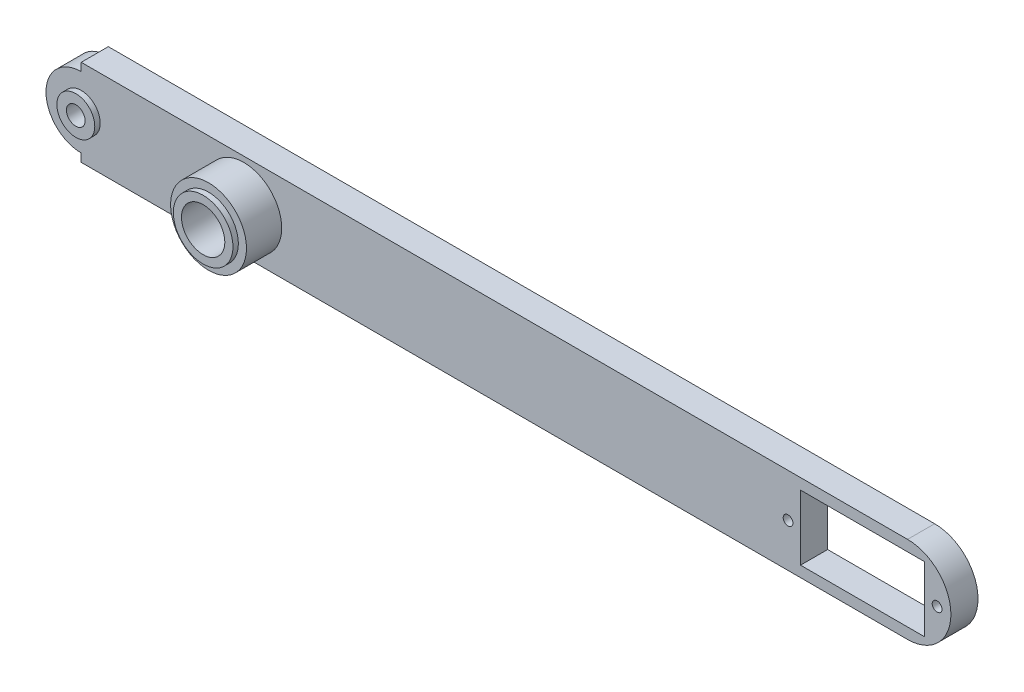
from build123d import *

# Parameters (mm, degrees)
BOSS_EXTRUDE1_START     = -9
SKETCH1_W               = 152.5
SKETCH1_H               = 16
BOSS_EXTRUDE1_DEPTH     = 5
BOSS_EXTRUDE2_START     = -9
SKETCH2_R               = 6.5
BOSS_EXTRUDE2_DEPTH     = 5
BOSS_EXTRUDE3_START     = -9
SKETCH3_R               = 8
BOSS_EXTRUDE3_DEPTH     = 5
BOSS_EXTRUDE4_START     = -9
SKETCH4_R               = 7
BOSS_EXTRUDE4_DEPTH     = 11.5
BOSS_EXTRUDE5_START     = 2.5
SKETCH5_R               = 5.5
BOSS_EXTRUDE5_DEPTH     = 1
BOSS_EXTRUDE6_START     = -4
SKETCH6_R               = 3.5
BOSS_EXTRUDE6_DEPTH     = 1
CUT_EXTRUDE1_DEPTH      = 132.054378027
CUT_EXTRUDE1_DEPTH_BACK = 132.054378027
SKETCH7_R               = 4
CUT_EXTRUDE2_DEPTH      = 132.054378027
CUT_EXTRUDE2_DEPTH_BACK = 132.054378027
SKETCH8_R               = 1.725
CUT_EXTRUDE3_DEPTH      = 132.054378027
CUT_EXTRUDE3_DEPTH_BACK = 132.054378027
SKETCH9_W               = 22.9
SKETCH9_H               = 12
CUT_EXTRUDE4_DEPTH      = 132.054378027
CUT_EXTRUDE4_DEPTH_BACK = 132.054378027
SKETCH10_R              = 0.9
CUT_EXTRUDE5_START      = -9
SKETCH11_R              = 2
CUT_EXTRUDE5_DEPTH      = 4


with BuildPart() as part:
    # Sketch1 → Boss-Extrude1 (new body)
    with BuildSketch(Plane.XY.offset(BOSS_EXTRUDE1_START)):
        with Locations((46.25, 0)):
            Rectangle(SKETCH1_W, SKETCH1_H)
    extrude(amount=BOSS_EXTRUDE1_DEPTH)

    # Sketch2 → Boss-Extrude2 (add)
    with BuildSketch(Plane.XY.offset(BOSS_EXTRUDE2_START)):
        with Locations((-30, 0)):
            Circle(SKETCH2_R)
    extrude(amount=BOSS_EXTRUDE2_DEPTH)

    # Sketch3 → Boss-Extrude3 (add)
    with BuildSketch(Plane.XY.offset(BOSS_EXTRUDE3_START)):
        with Locations((122.5, 0)):
            Circle(SKETCH3_R)
    extrude(amount=BOSS_EXTRUDE3_DEPTH)

    # Sketch4 → Boss-Extrude4 (add)
    with BuildSketch(Plane.XY.offset(BOSS_EXTRUDE4_START)):
        Circle(SKETCH4_R)
    extrude(amount=BOSS_EXTRUDE4_DEPTH)

    # Sketch5 → Boss-Extrude5 (add)
    with BuildSketch(Plane.XY.offset(BOSS_EXTRUDE5_START)):
        Circle(SKETCH5_R)
    extrude(amount=BOSS_EXTRUDE5_DEPTH)

    # Sketch6 → Boss-Extrude6 (add)
    with BuildSketch(Plane.XY.offset(BOSS_EXTRUDE6_START)):
        with Locations((-30, 0)):
            Circle(SKETCH6_R)
    extrude(amount=BOSS_EXTRUDE6_DEPTH)

    # Sketch7 → Cut-Extrude1 (cut, two sides: drawn at the far end of the back side and taken through both)
    with BuildSketch(Plane.XY.offset(-CUT_EXTRUDE1_DEPTH_BACK)):
        Circle(SKETCH7_R)
    extrude(amount=CUT_EXTRUDE1_DEPTH + CUT_EXTRUDE1_DEPTH_BACK, mode=Mode.SUBTRACT)

    # Sketch8 → Cut-Extrude2 (cut, two sides: drawn at the far end of the back side and taken through both)
    with BuildSketch(Plane.XY.offset(-CUT_EXTRUDE2_DEPTH_BACK)):
        with Locations((-30, 0)):
            Circle(SKETCH8_R)
    extrude(amount=CUT_EXTRUDE2_DEPTH + CUT_EXTRUDE2_DEPTH_BACK, mode=Mode.SUBTRACT)

    # Sketch9 → Cut-Extrude3 (cut, two sides: drawn at the far end of the back side and taken through both)
    with BuildSketch(Plane.XY.offset(-CUT_EXTRUDE3_DEPTH_BACK)):
        with Locations((114.2, 0)):
            Rectangle(SKETCH9_W, SKETCH9_H)
    extrude(amount=CUT_EXTRUDE3_DEPTH + CUT_EXTRUDE3_DEPTH_BACK, mode=Mode.SUBTRACT)

    # Sketch10 → Cut-Extrude4 (cut, two sides: drawn at the far end of the back side and taken through both)
    with BuildSketch(Plane.XY.offset(-CUT_EXTRUDE4_DEPTH_BACK)):
        with Locations((100.45, 0)):
            Circle(SKETCH10_R)
        with Locations((127.95, 0)):
            Circle(SKETCH10_R)
    extrude(amount=CUT_EXTRUDE4_DEPTH + CUT_EXTRUDE4_DEPTH_BACK, mode=Mode.SUBTRACT)

    # Sketch11 → Cut-Extrude5 (cut)
    with BuildSketch(Plane.XY.offset(CUT_EXTRUDE5_START)):
        with Locations((40, 0)):
            Circle(SKETCH11_R)
        with Locations((75, 0)):
            Circle(SKETCH11_R)
    extrude(amount=CUT_EXTRUDE5_DEPTH, mode=Mode.SUBTRACT)


solid = part.part
